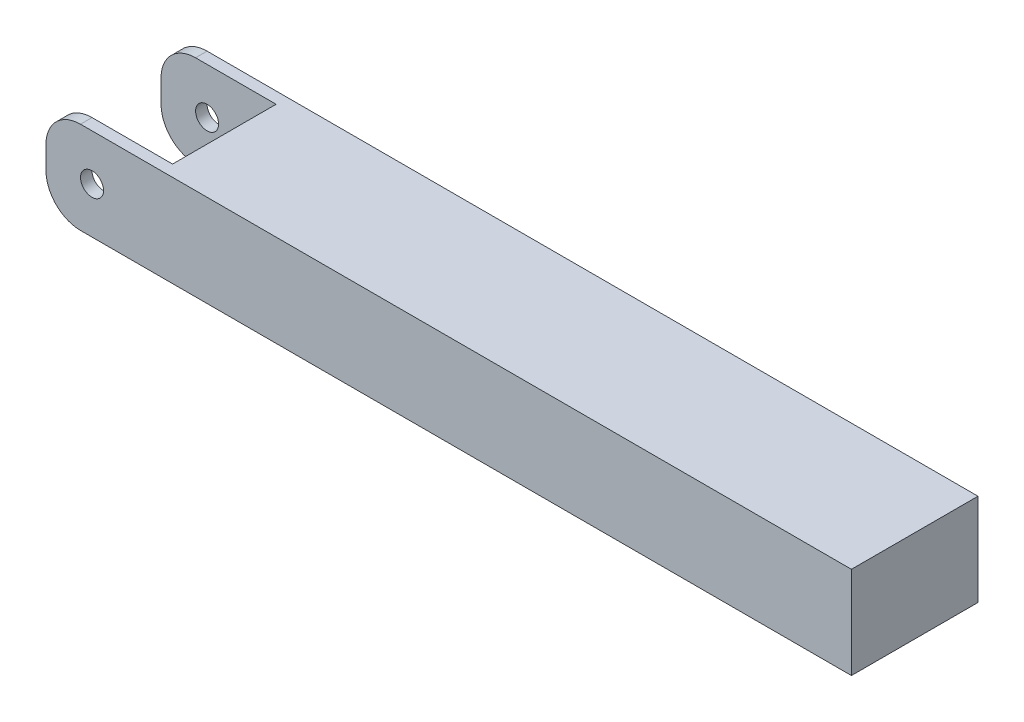
from build123d import *

# Parameters (mm, degrees)
SKETCH1_W            = 300
SKETCH1_H            = 40
BOSS_EXTRUDE1_DEPTH  = 22.5
SKETCH2_W            = 350
SKETCH2_H            = 40
SKETCH2_R            = 5
BOSS_EXTRUDE2_DEPTH  = 5
FILLET1_R            = 15
FILLET1_OF_MIRROR1_R = 15


with BuildPart() as part:
    # Sketch1 → Boss-Extrude1 (new, symmetric)
    with BuildSketch(Plane.XY):
        Rectangle(SKETCH1_W, SKETCH1_H)
    extrude(amount=BOSS_EXTRUDE1_DEPTH, both=True)

    # Sketch2 → Boss-Extrude2 (add)
    with BuildSketch(Plane.XY.offset(22.5)):
        with Locations((-25, 0)):
            Rectangle(SKETCH2_W, SKETCH2_H)
        with Locations((-180, 0)):
            Circle(SKETCH2_R, mode=Mode.SUBTRACT)
    boss_extrude2 = extrude(amount=BOSS_EXTRUDE2_DEPTH)

    # Fillet1
    fillet1_edges = [part.edges().sort_by_distance(p)[0] for p in [
        (-200, -20, 25),
        (-200, 20, 25),
    ]]
    fillet(fillet1_edges, radius=FILLET1_R)

    # Mirror1: Boss-Extrude2 across plane
    add(boss_extrude2.mirror(Plane.XY))

    # Fillet1 of Mirror1
    fillet1_of_mirror1_edges = [part.edges().sort_by_distance(p)[0] for p in [
        (-200, -20, -25),
        (-200, 20, -25),
    ]]
    fillet(fillet1_of_mirror1_edges, radius=FILLET1_OF_MIRROR1_R)


solid = part.part
